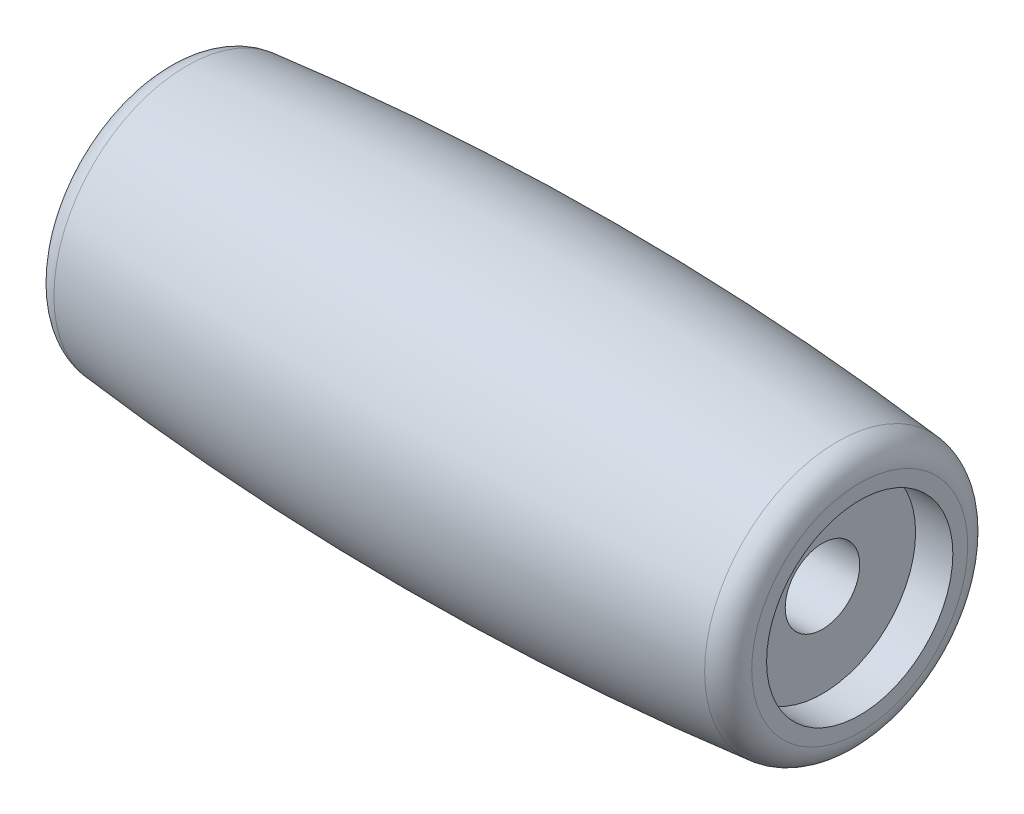
from build123d import *

# Parameters (mm, degrees)
FILLET1_R = 1


with BuildPart() as part:
    # Sketch1 → Revolve1 (revolve)
    with BuildSketch(Plane.XY, mode=Mode.PRIVATE) as revolve1_sk:
        with BuildLine():
            Line((-14, 3.75), (-12.5, 3.75))
            Line((-12.5, 3.75), (-12.5, 1.5))
            Line((-12.5, 1.5), (12.5, 1.5))
            Line((12.5, 1.5), (12.5, 3.75))
            Line((12.5, 3.75), (14, 3.75))
            Line((14, 3.75), (14, 5.25))
            ThreePointArc((14, 5.25), (0, 6), (-14, 5.25))
            Line((-14, 5.25), (-14, 3.75))
        make_face()
    revolve(revolve1_sk.sketch.rotate(Axis((0, 0, 0), (1, 0, 0)), 90), axis=Axis((0, 0, 0), (1, 0, 0)))

    # Fillet1
    fillet1_edges = [part.edges().sort_by_distance(p)[0] for p in [
        (-14, 0, -5.25),
        (14, 0, -5.25),
    ]]
    fillet(fillet1_edges, radius=FILLET1_R)


solid = part.part
